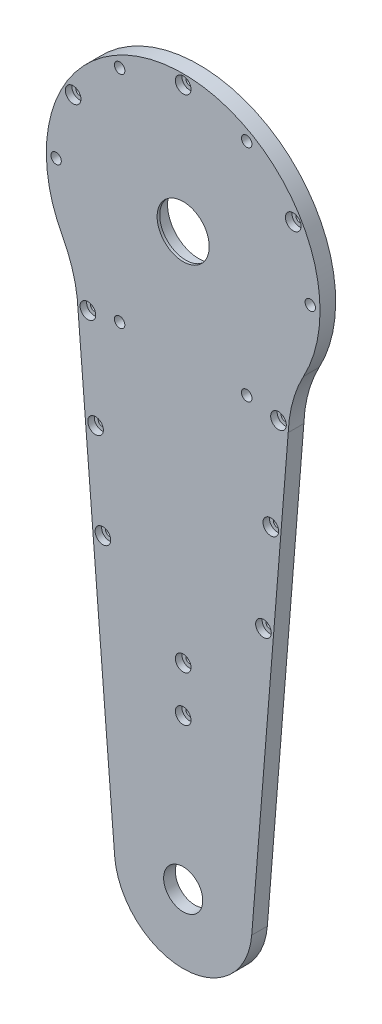
from build123d import *

# Parameters (mm, degrees)
SKETCH2_R               = 2.05
SKETCH2_R_2             = 12
SKETCH2_R_3             = 7.5
SKETCH2_R_4             = 1.5
BOSS_EXTRUDE1_DEPTH     = 6
SKETCH3_R               = 20
SKETCH3_R_2             = 10
EXTRUDE_THIN1_DEPTH     = 1
SKETCH4_R               = 2
CUT_EXTRUDE1_DEPTH      = 10
CUT_EXTRUDE_THIN1_START = -2.5
SKETCH5_R               = 3
SKETCH5_R_2             = 1.5
CUT_EXTRUDE_THIN1_DEPTH = 2.5
SKETCH7_R               = 14
CUT_EXTRUDE2_DEPTH      = 1.5
SKETCH8_R               = 1.5
CUT_EXTRUDE3_DEPTH      = 6
SKETCH9_R               = 3
CUT_EXTRUDE4_DEPTH      = 2.5


with BuildPart() as part:
    # Sketch2 → Boss-Extrude1 (new body)
    # profile 1 of 9: a face of its own
    with BuildSketch(Plane.XY):
        with BuildLine():
            ThreePointArc((-40.298912311, -46.606767419), (-42.008200294, -35.467381848), (-46.168839402, -24.993764587))
            ThreePointArc((-46.168839402, -24.993764587), (0, 52.5), (46.168839402, -24.993764587))
            ThreePointArc((46.168839402, -24.993764587), (42.008200294, -35.467381848), (40.298912311, -46.606767419))
            Line((40.298912311, -46.606767419), (26.292022516, -220.606767419))
            ThreePointArc((26.292022516, -220.606767419), (0, -244.876294602), (-26.292022516, -220.606767419))
            Line((-26.292022516, -220.606767419), (-40.298912311, -46.606767419))
        make_face()
        with Locations((0, -143.308369457)):
            Circle(SKETCH2_R, mode=Mode.SUBTRACT)
        with Locations((0, -160.808369457)):
            Circle(SKETCH2_R, mode=Mode.SUBTRACT)
        with Locations((30.798475656, -116.417934033)):
            Circle(SKETCH2_R, mode=Mode.SUBTRACT)
        with Locations((-30.798475656, -116.417934033)):
            Circle(SKETCH2_R, mode=Mode.SUBTRACT)
        with Locations((-33.615171456, -81.26615187)):
            Circle(SKETCH2_R, mode=Mode.SUBTRACT)
        with Locations((-36.560893536, -44.504148362)):
            Circle(SKETCH2_R, mode=Mode.SUBTRACT)
        with Locations((33.615171456, -81.26615187)):
            Circle(SKETCH2_R, mode=Mode.SUBTRACT)
        with Locations((36.560893536, -44.504148362)):
            Circle(SKETCH2_R, mode=Mode.SUBTRACT)
        Circle(SKETCH2_R_2, mode=Mode.SUBTRACT)
        with Locations((0, -218.5)):
            Circle(SKETCH2_R_3, mode=Mode.SUBTRACT)
    # profile 2 of 9: a face of its own
    with BuildSketch(Plane.XY):
        with Locations((30.798475656, -116.417934033)):
            Circle(SKETCH2_R)
        with Locations((30.798475656, -116.417934033)):
            Circle(SKETCH2_R_4, mode=Mode.SUBTRACT)
    # profile 3 of 9: a face of its own
    with BuildSketch(Plane.XY):
        with Locations((33.615171456, -81.26615187)):
            Circle(SKETCH2_R)
        with Locations((33.615171456, -81.26615187)):
            Circle(SKETCH2_R_4, mode=Mode.SUBTRACT)
    # profile 4 of 9: a face of its own
    with BuildSketch(Plane.XY):
        with Locations((36.560893536, -44.504148362)):
            Circle(SKETCH2_R)
        with Locations((36.560893536, -44.504148362)):
            Circle(SKETCH2_R_4, mode=Mode.SUBTRACT)
    # profile 5 of 9: a face of its own
    with BuildSketch(Plane.XY):
        with Locations((-36.560893536, -44.504148362)):
            Circle(SKETCH2_R)
        with Locations((-36.560893536, -44.504148362)):
            Circle(SKETCH2_R_4, mode=Mode.SUBTRACT)
    # profile 6 of 9: a face of its own
    with BuildSketch(Plane.XY):
        with Locations((-33.615171456, -81.26615187)):
            Circle(SKETCH2_R)
        with Locations((-33.615171456, -81.26615187)):
            Circle(SKETCH2_R_4, mode=Mode.SUBTRACT)
    # profile 7 of 9: a face of its own
    with BuildSketch(Plane.XY):
        with Locations((-30.798475656, -116.417934033)):
            Circle(SKETCH2_R)
        with Locations((-30.798475656, -116.417934033)):
            Circle(SKETCH2_R_4, mode=Mode.SUBTRACT)
    # profile 8 of 9: a face of its own
    with BuildSketch(Plane.XY):
        with Locations((0, -143.308369457)):
            Circle(SKETCH2_R)
        with Locations((0, -143.308369457)):
            Circle(SKETCH2_R_4, mode=Mode.SUBTRACT)
    # profile 9 of 9: a face of its own
    with BuildSketch(Plane.XY):
        with Locations((0, -160.808369457)):
            Circle(SKETCH2_R)
        with Locations((0, -160.808369457)):
            Circle(SKETCH2_R_4, mode=Mode.SUBTRACT)
    extrude(amount=BOSS_EXTRUDE1_DEPTH)

    # Sketch3 → Extrude-Thin1 (add)
    with BuildSketch(Plane.XY.offset(6)):
        Circle(SKETCH3_R)
        Circle(SKETCH3_R_2, mode=Mode.SUBTRACT)
    extrude(amount=-EXTRUDE_THIN1_DEPTH)

    # Sketch4 → Cut-Extrude1 (cut)
    with BuildSketch(Plane(origin=(0, 0, 0), x_dir=(-1, 0, 0), z_dir=(0, 0, -1))):
        with Locations((-48.75, 0)):
            Circle(SKETCH4_R)
        with Locations((-24.375, 42.218738434)):
            Circle(SKETCH4_R)
        with Locations((24.375, 42.218738434)):
            Circle(SKETCH4_R)
        with Locations((48.75, 0)):
            Circle(SKETCH4_R)
        with Locations((24.375, -42.218738434)):
            Circle(SKETCH4_R)
        with Locations((-24.375, -42.218738434)):
            Circle(SKETCH4_R)
    extrude(amount=-CUT_EXTRUDE1_DEPTH, mode=Mode.SUBTRACT)

    # Sketch5 → Cut-Extrude-Thin1 (cut)
    # profile 1 of 8: a face of its own
    with BuildSketch(Plane.XY.offset(6).offset(CUT_EXTRUDE_THIN1_START)):
        with Locations((36.560893536, -44.504148362)):
            Circle(SKETCH5_R)
        with Locations((36.560893536, -44.504148362)):
            Circle(SKETCH5_R_2, mode=Mode.SUBTRACT)
    # profile 2 of 8: a face of its own
    with BuildSketch(Plane.XY.offset(6).offset(CUT_EXTRUDE_THIN1_START)):
        with Locations((30.798475656, -116.417934033)):
            Circle(SKETCH5_R)
        with Locations((30.798475656, -116.417934033)):
            Circle(SKETCH5_R_2, mode=Mode.SUBTRACT)
    # profile 3 of 8: a face of its own
    with BuildSketch(Plane.XY.offset(6).offset(CUT_EXTRUDE_THIN1_START)):
        with Locations((33.615171456, -81.26615187)):
            Circle(SKETCH5_R)
        with Locations((33.615171456, -81.26615187)):
            Circle(SKETCH5_R_2, mode=Mode.SUBTRACT)
    # profile 4 of 8: a face of its own
    with BuildSketch(Plane.XY.offset(6).offset(CUT_EXTRUDE_THIN1_START)):
        with Locations((0, -160.808369457)):
            Circle(SKETCH5_R)
        with Locations((0, -160.808369457)):
            Circle(SKETCH5_R_2, mode=Mode.SUBTRACT)
    # profile 5 of 8: a face of its own
    with BuildSketch(Plane.XY.offset(6).offset(CUT_EXTRUDE_THIN1_START)):
        with Locations((0, -143.308369457)):
            Circle(SKETCH5_R)
        with Locations((0, -143.308369457)):
            Circle(SKETCH5_R_2, mode=Mode.SUBTRACT)
    # profile 6 of 8: a face of its own
    with BuildSketch(Plane.XY.offset(6).offset(CUT_EXTRUDE_THIN1_START)):
        with Locations((-30.798475656, -116.417934033)):
            Circle(SKETCH5_R)
        with Locations((-30.798475656, -116.417934033)):
            Circle(SKETCH5_R_2, mode=Mode.SUBTRACT)
    # profile 7 of 8: a face of its own
    with BuildSketch(Plane.XY.offset(6).offset(CUT_EXTRUDE_THIN1_START)):
        with Locations((-33.615171456, -81.26615187)):
            Circle(SKETCH5_R)
        with Locations((-33.615171456, -81.26615187)):
            Circle(SKETCH5_R_2, mode=Mode.SUBTRACT)
    # profile 8 of 8: a face of its own
    with BuildSketch(Plane.XY.offset(6).offset(CUT_EXTRUDE_THIN1_START)):
        with Locations((-36.560893536, -44.504148362)):
            Circle(SKETCH5_R)
        with Locations((-36.560893536, -44.504148362)):
            Circle(SKETCH5_R_2, mode=Mode.SUBTRACT)
    extrude(amount=CUT_EXTRUDE_THIN1_DEPTH, mode=Mode.SUBTRACT)

    # Sketch7 → Cut-Extrude2 (cut)
    with BuildSketch(Plane(origin=(0, 0, 0), x_dir=(-1, 0, 0), z_dir=(0, 0, -1))):
        with Locations((0, -218.5)):
            Circle(SKETCH7_R)
    extrude(amount=-CUT_EXTRUDE2_DEPTH, mode=Mode.SUBTRACT)

    # Sketch8 → Cut-Extrude3 (cut)
    with BuildSketch(Plane.XY.offset(6)):
        with Locations((0, 48.75)):
            Circle(SKETCH8_R)
        with Locations((42.218738434, 24.375)):
            Circle(SKETCH8_R)
        with Locations((-42.218738434, 24.375)):
            Circle(SKETCH8_R)
    extrude(amount=-CUT_EXTRUDE3_DEPTH, mode=Mode.SUBTRACT)

    # Sketch9 → Cut-Extrude4 (cut)
    with BuildSketch(Plane.XY.offset(6)):
        with Locations((-42.218738434, 24.375)):
            Circle(SKETCH9_R)
        with Locations((0, 48.75)):
            Circle(SKETCH9_R)
        with Locations((42.218738434, 24.375)):
            Circle(SKETCH9_R)
    extrude(amount=-CUT_EXTRUDE4_DEPTH, mode=Mode.SUBTRACT)


solid = part.part
